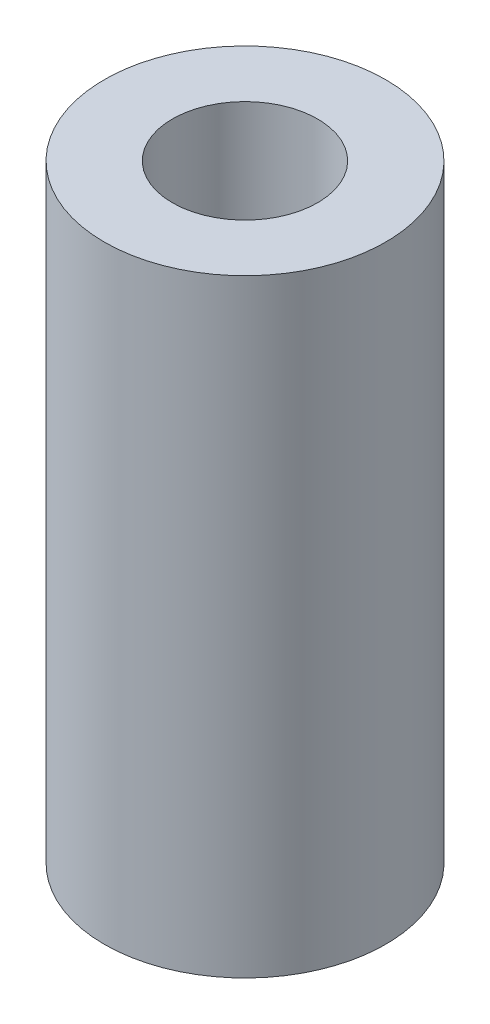
from build123d import *

# Parameters (mm, degrees)
SKETCH_1_R      = 3.1
SKETCH_1_R_2    = 1.6
EXTRUDE_1_DEPTH = 13.4


with BuildPart() as part:
    # 草图1 → 凸台-拉伸1 (new body)
    with BuildSketch(Plane(origin=(0, 0, 0), x_dir=(1, 0, 0), z_dir=(0, 1, 0))):
        with Locations(Location((0, 0, 0), (0, 0, 270))):
            Circle(SKETCH_1_R)
        with Locations(Location((0, 0, 0), (0, 0, 270))):
            Circle(SKETCH_1_R_2, mode=Mode.SUBTRACT)
    extrude(amount=EXTRUDE_1_DEPTH)


solid = part.part
